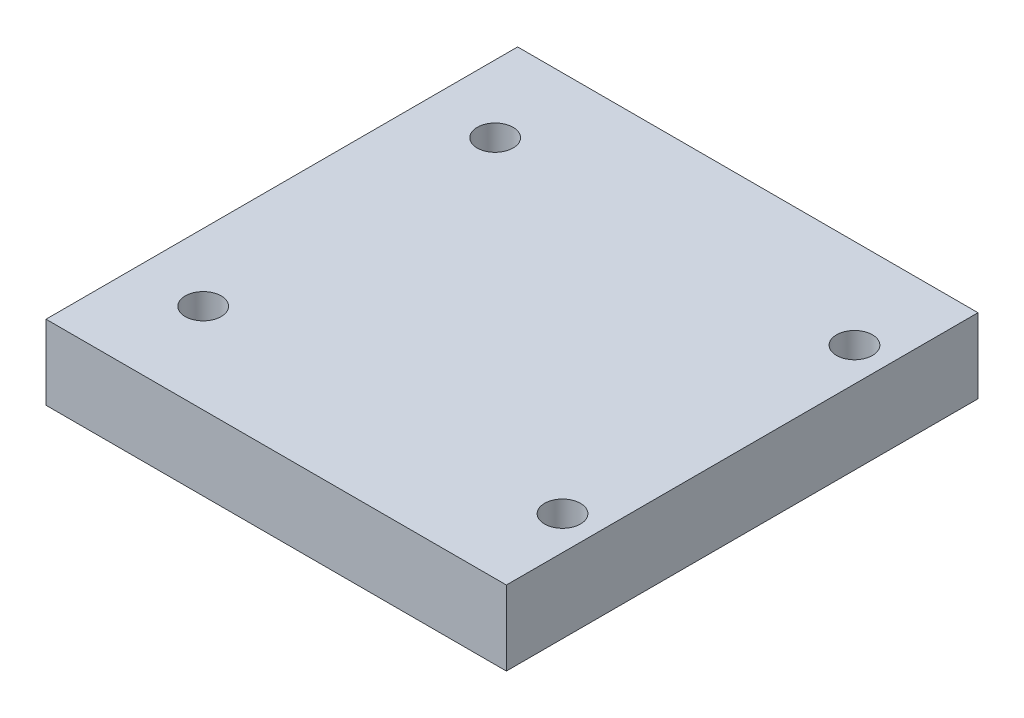
from build123d import *

# Parameters (mm, degrees)
SKETCH1_W               = 65.0875
SKETCH1_H               = 66.675
BOSS_EXTRUDE2_DEPTH     = 10.541
CUT_EXTRUDE1_DEPTH      = 74.460605516
CUT_EXTRUDE1_DEPTH_BACK = 74.460605516
SKETCH3_R               = 2.54


with BuildPart() as part:
    # Sketch1 → Boss-Extrude2 (new body)
    with BuildSketch(Plane(origin=(0, 0, 0), x_dir=(1, 0, 0), z_dir=(0, 1, 0))):
        with Locations((-26.973498692, 8.412290298)):
            Rectangle(SKETCH1_W, SKETCH1_H)
    extrude(amount=BOSS_EXTRUDE2_DEPTH)

    # Sketch3 → Cut-Extrude1 (cut, two sides: drawn at the far end of the back side and taken through both)
    with BuildSketch(Plane(origin=(0, 10.541, 0), x_dir=(1, 0, 0), z_dir=(0, 1, 0)).offset(-CUT_EXTRUDE1_DEPTH_BACK)):
        with Locations(Location((-49.992248692, 29.049790298, 0), (0, 0, 270))):
            Circle(SKETCH3_R)
        with Locations(Location((0.807751308, 29.049790298, 0), (0, 0, 270))):
            Circle(SKETCH3_R)
        with Locations(Location((-49.992248692, -12.225209702, 0), (0, 0, 270))):
            Circle(SKETCH3_R)
        with Locations(Location((0.807751308, -12.225209702, 0), (0, 0, 270))):
            Circle(SKETCH3_R)
    extrude(amount=CUT_EXTRUDE1_DEPTH + CUT_EXTRUDE1_DEPTH_BACK, mode=Mode.SUBTRACT)


solid = part.part
